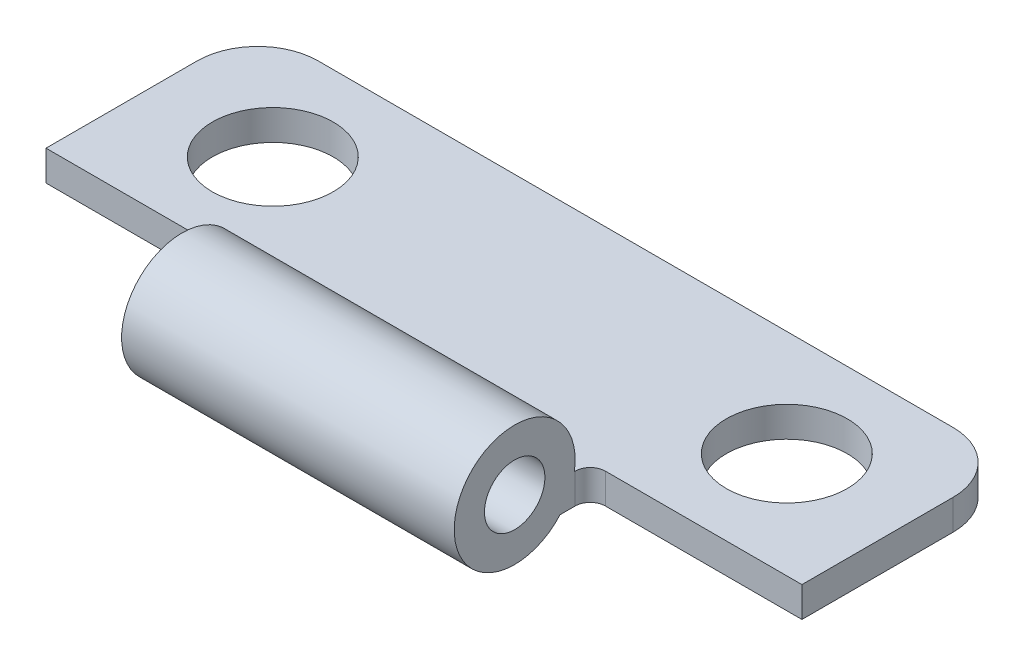
from build123d import *

# Parameters (mm, degrees)
SKETCH_1_R      = 2
EXTRUDE_1_DEPTH = 1
FILLET_1_R      = 2
FILLET_2_R      = 0.5
SKETCH_3_R      = 2
SKETCH_3_R_2    = 1
EXTRUDE_2_DEPTH = 5.5


with BuildPart() as part:
    # 草图1 → 凸台-拉伸1 (new body)
    with BuildSketch(Plane(origin=(0, 0, 0), x_dir=(1, 0, 0), z_dir=(0, 1, 0))):
        Polygon((-12.5, 1), (-5.5, 1), (-5.5, 0), (5.5, 0), (5.5, 1), (12.5, 1), (12.5, 8), (-12.5, 8), align=None)
        with Locations(Location((8.5, 4.5, 0), (0, 0, 270))):
            Circle(SKETCH_1_R, mode=Mode.SUBTRACT)
        with Locations(Location((-8.5, 4.5, 0), (0, 0, 270))):
            Circle(SKETCH_1_R, mode=Mode.SUBTRACT)
    extrude(amount=EXTRUDE_1_DEPTH)

    # 圆角1
    fillet_1_edges = [part.edges().sort_by_distance(p)[0] for p in [
        (-12.5, 0.5, -8),
        (12.5, 0.5, -8),
    ]]
    fillet(fillet_1_edges, radius=FILLET_1_R)

    # 圆角2
    fillet_2_edges = [part.edges().sort_by_distance(p)[0] for p in [
        (5.5, 0.5, -1),
        (-5.5, 0.5, -1),
    ]]
    fillet(fillet_2_edges, radius=FILLET_2_R)

    # 草图3 → 凸台-拉伸2 (add, symmetric)
    with BuildSketch(Plane(origin=(0, 0, 0), x_dir=(0, 0, -1), z_dir=(1, 0, 0))):
        with Locations((-1.5, 1.322875656)):
            Circle(SKETCH_3_R)
        with Locations((-1.5, 1.322875656)):
            Circle(SKETCH_3_R_2, mode=Mode.SUBTRACT)
    extrude(amount=EXTRUDE_2_DEPTH, both=True)


solid = part.part
